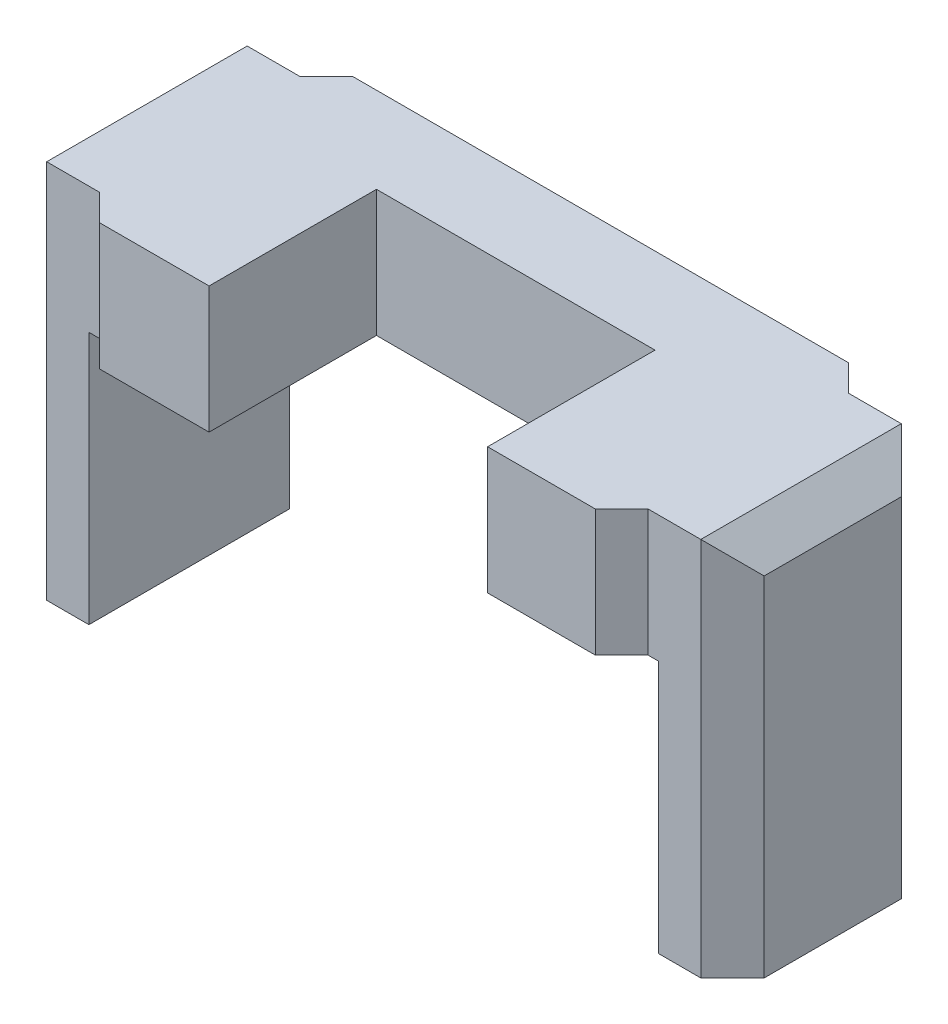
from build123d import *

# Parameters (mm, degrees)
SKETCH1_W                = 52
SKETCH1_H                = 24
SKETCH1_R                = 8.25
BOSS_EXTRUDE1_DEPTH      = 12
SKETCH2_R                = 1
CUT_EXTRUDE1_DEPTH       = 32.048349393
SKETCH3_R                = 1.75
CUT_EXTRUDE2_DEPTH       = 1
CUT_EXTRUDE3_DEPTH       = 5
FILLET3_R                = 0.5
CHAMFER1_SIZE            = 2.5
SKETCH5_W                = 19
SKETCH5_H                = 12
BOSS_EXTRUDE2_DEPTH      = 8
SKETCH6_W                = 7
SKETCH6_H                = 19
BOSS_EXTRUDE3_DEPTH      = 24
CHAMFER2_SIZE            = 3
CHAMFER2_OF_MIRROR1_SIZE = 3
SKETCH7_W                = 14
SKETCH7_H                = 8
CUT_EXTRUDE4_DEPTH       = 5
FILLET4_R                = 0.5
BOSS_EXTRUDE4_DEPTH      = 12
SKETCH9_W                = 26.398994769
SKETCH9_H                = 16
CUT_EXTRUDE5_DEPTH       = 13


with BuildPart() as part:
    # Sketch1 → Boss-Extrude1 (new body)
    with BuildSketch(Plane(origin=(0, 0, 0), x_dir=(1, 0, 0), z_dir=(0, 1, 0))):
        Rectangle(SKETCH1_W, SKETCH1_H)
        with Locations(Location((12.75, 0, 0), (0, 0, 270))):
            Circle(SKETCH1_R, mode=Mode.SUBTRACT)
        with Locations(Location((-12.75, 0, 0), (0, 0, 270))):
            Circle(SKETCH1_R, mode=Mode.SUBTRACT)
    extrude(amount=BOSS_EXTRUDE1_DEPTH)

    # Sketch2 → Cut-Extrude1 (cut, through all)
    with BuildSketch(Plane(origin=(0, 12, 0), x_dir=(1, 0, 0), z_dir=(0, 1, 0))):
        with Locations(Location((-21.35, 8.85, 0), (0, 0, 270))):
            Circle(SKETCH2_R)
        with Locations(Location((21.35, 8.85, 0), (0, 0, 270))):
            Circle(SKETCH2_R)
        with Locations(Location((21.35, -8.85, 0), (0, 0, 270))):
            Circle(SKETCH2_R)
        with Locations(Location((-21.35, -8.85, 0), (0, 0, 270))):
            Circle(SKETCH2_R)
    extrude(amount=-CUT_EXTRUDE1_DEPTH, mode=Mode.SUBTRACT)

    # Sketch3 → Cut-Extrude2 (cut)
    with BuildSketch(Plane(origin=(0, 12, 0), x_dir=(1, 0, 0), z_dir=(0, 1, 0))):
        with Locations(Location((-21.35, 8.85, 0), (0, 0, 270))):
            Circle(SKETCH3_R)
        with Locations(Location((21.35, 8.85, 0), (0, 0, 270))):
            Circle(SKETCH3_R)
        with Locations(Location((21.35, -8.85, 0), (0, 0, 270))):
            Circle(SKETCH3_R)
        with Locations(Location((-21.35, -8.85, 0), (0, 0, 270))):
            Circle(SKETCH3_R)
    extrude(amount=-CUT_EXTRUDE2_DEPTH, mode=Mode.SUBTRACT)

    # Sketch4 → Cut-Extrude3 (cut)
    with BuildSketch(Plane.XZ):
        Polygon((-6, -5), (-6, -12), (6, -12), (6, -5), (0, -5), align=None)
    extrude(amount=-CUT_EXTRUDE3_DEPTH, mode=Mode.SUBTRACT)

    # Fillet3
    fillet3_edges = [part.edges().sort_by_distance(p)[0] for p in [
        (-6, 2.5, -5),
        (6, 5, -8.5),
        (6, 2.5, -5),
        (-6, 5, -8.5),
        (0, 5, -5),
    ]]
    fillet(fillet3_edges, radius=FILLET3_R)

    # Chamfer1
    chamfer1_edges = [part.edges().sort_by_distance(p)[0] for p in [
        (26, 6, 12),
        (-26, 6, 12),
        (-26, 6, -12),
        (26, 6, -12),
    ]]
    chamfer(chamfer1_edges, length=CHAMFER1_SIZE)

    # Sketch5 → Boss-Extrude2 (add)
    with BuildSketch(Plane.ZY.offset(26)):
        with Locations((0, 6)):
            Rectangle(SKETCH5_W, SKETCH5_H)
    boss_extrude2 = extrude(amount=BOSS_EXTRUDE2_DEPTH)

    # Sketch6 → Boss-Extrude3 (add)
    with BuildSketch(Plane.XZ):
        with Locations((-30.5, 0)):
            Rectangle(SKETCH6_W, SKETCH6_H)
    boss_extrude3 = extrude(amount=BOSS_EXTRUDE3_DEPTH)

    # Chamfer2
    chamfer2_edges = [part.edges().sort_by_distance(p)[0] for p in [
        (-34, -6, 9.5),
        (-34, 12, 0),
        (-34, -6, -9.5),
    ]]
    chamfer(chamfer2_edges, length=CHAMFER2_SIZE)

    # Mirror1: Boss-Extrude2, Boss-Extrude3 across plane
    add(boss_extrude2.mirror(Plane(origin=(0, 0, 0), x_dir=(0, 0, 1), z_dir=(1, 0, 0))))
    add(boss_extrude3.mirror(Plane(origin=(0, 0, 0), x_dir=(0, 0, 1), z_dir=(1, 0, 0))))

    # Chamfer2 of Mirror1
    chamfer2_of_mirror1_edges = [part.edges().sort_by_distance(p)[0] for p in [
        (34, -6, 9.5),
        (34, 12, 0),
        (34, -6, -9.5),
    ]]
    chamfer(chamfer2_of_mirror1_edges, length=CHAMFER2_OF_MIRROR1_SIZE)

    # Sketch7 → Cut-Extrude4 (cut)
    with BuildSketch(Plane.XZ):
        with Locations((0, 12)):
            Rectangle(SKETCH7_W, SKETCH7_H)
    extrude(amount=-CUT_EXTRUDE4_DEPTH, mode=Mode.SUBTRACT)

    # Fillet4
    fillet4_edges = [part.edges().sort_by_distance(p)[0] for p in [
        (-7, 2.5, 8),
        (7, 5, 10),
        (0, 5, 8),
        (-7, 5, 10),
        (7, 2.5, 8),
    ]]
    fillet(fillet4_edges, radius=FILLET4_R)

    # Sketch8 → Boss-Extrude4 (add)
    with BuildSketch(Plane.XZ):
        Polygon((-7, 12), (7, 12), (23.5, 12), (26, 9.5), (27, 9.5), (27, -9.5), (26, -9.5), (23.5, -12), (6, -12), (-6, -12), (-23.5, -12), (-26, -9.5), (-27, -9.5), (-27, 9.5), (-26, 9.5), (-23.5, 12), align=None)
    extrude(amount=-BOSS_EXTRUDE4_DEPTH)

    # Sketch9 → Cut-Extrude5 (cut)
    with BuildSketch(Plane.XZ):
        with Locations((0.089665153, 4.133644411)):
            Rectangle(SKETCH9_W, SKETCH9_H)
    extrude(amount=-CUT_EXTRUDE5_DEPTH, mode=Mode.SUBTRACT)


solid = part.part
